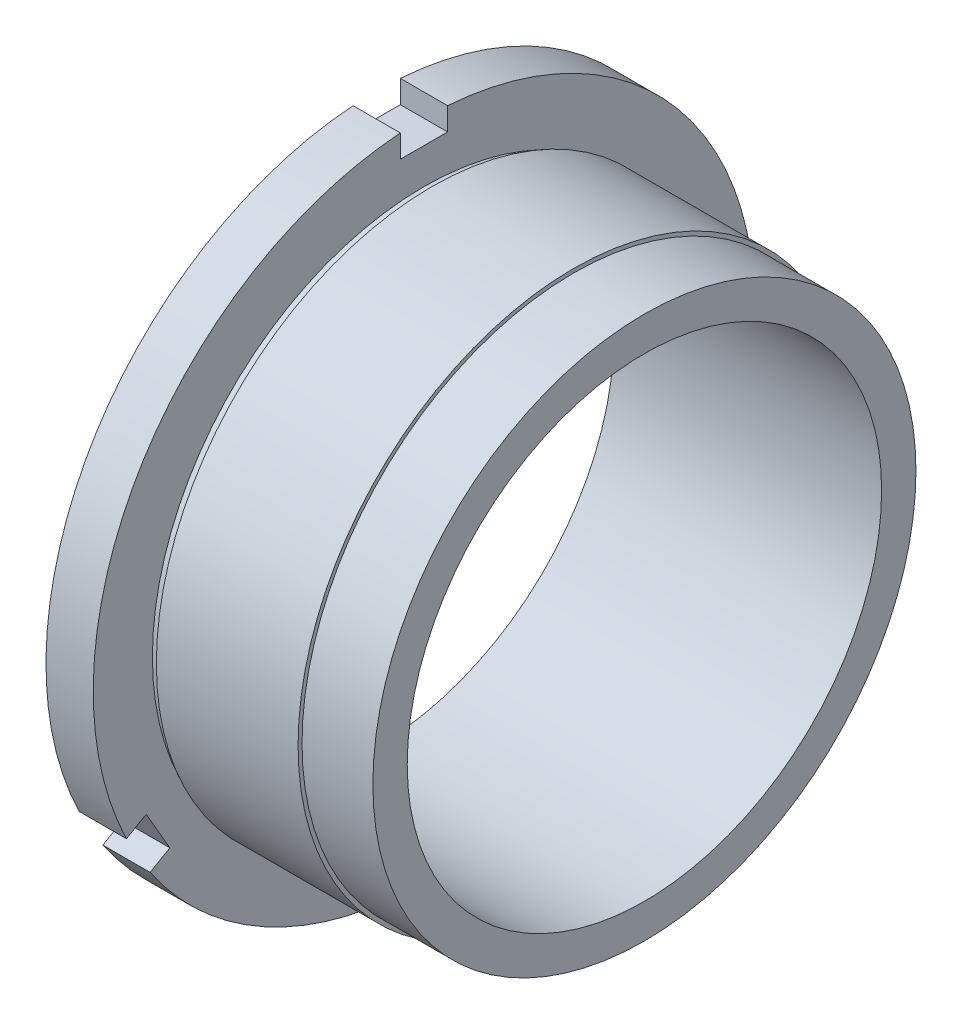
from build123d import *

# Parameters (mm, degrees)
SKETCH2_W          = 6
SKETCH2_H          = 5.216797091
CUT_EXTRUDE1_DEPTH = 69.439754529
CIRPATTERN1_COUNT  = 3


with BuildPart() as part:
    # Sketch1 → Revolve1 (revolve)
    with BuildSketch(Plane.XY, mode=Mode.PRIVATE) as revolve1_sk:
        Polygon((0, 30.125), (0, 42), (6, 42), (6, 34.485), (7, 34.485), (7, 34.985), (25, 34.985), (25, 34.485), (34, 34.485), (34, 30.125), align=None)
    revolve(revolve1_sk.sketch.rotate(Axis((0, 0, 0), (-1, 0, 0)), 90), axis=Axis((0, 0, 0), (-1, 0, 0)))

    # Sketch2 → Cut-Extrude1 (cut, through all)
    with BuildSketch(Plane.ZY):
        with Locations((0, 41.608398546)):
            Rectangle(SKETCH2_W, SKETCH2_H)
    cut_extrude1 = extrude(amount=-CUT_EXTRUDE1_DEPTH, mode=Mode.SUBTRACT)

    # CirPattern1: Cut-Extrude1 ×3 about axis
    cirpattern1_axis = Axis((0, 0, 0), (1, 0, 0))
    for i in range(1, CIRPATTERN1_COUNT):
        add(cut_extrude1.rotate(cirpattern1_axis, i * 360 / CIRPATTERN1_COUNT), mode=Mode.SUBTRACT)


solid = part.part
